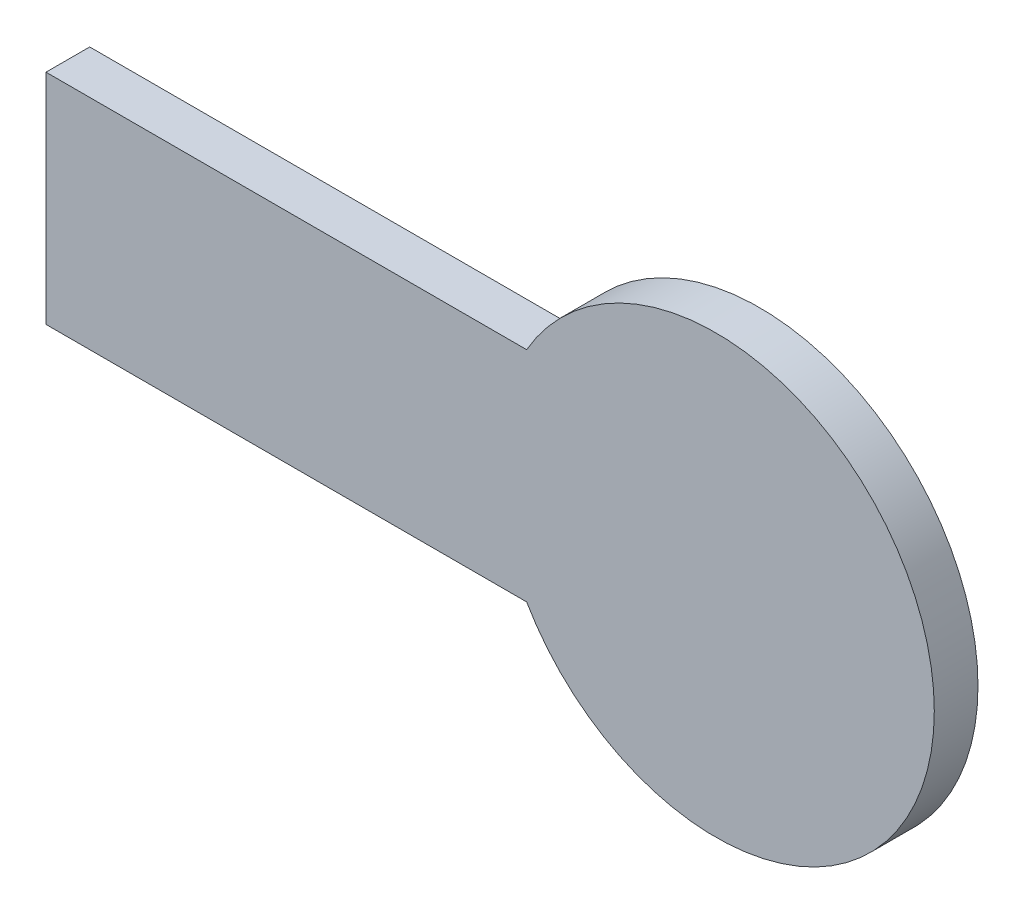
from build123d import *

# Parameters (mm, degrees)
BOSS_EXTRUDE1_DEPTH = 10


with BuildPart() as part:
    # Sketch1 → Boss-Extrude1 (new body)
    with BuildSketch(Plane.XY):
        with BuildLine():
            Line((-153.301270189, -25), (-153.301270189, 25))
            Line((-153.301270189, 25), (-43.301270189, 25))
            ThreePointArc((-43.301270189, 25), (50, 0), (-43.301270189, -25))
            Line((-43.301270189, -25), (-153.301270189, -25))
        make_face()
    extrude(amount=BOSS_EXTRUDE1_DEPTH)


solid = part.part
